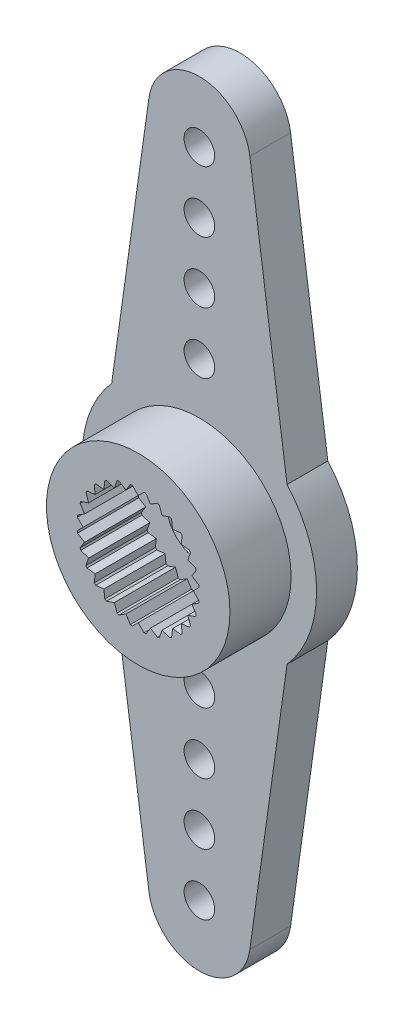
from build123d import *

# Parameters (mm, degrees)
ESQUISSE1_R                  = 5.75
ESQUISSE1_R_2                = 1.6
BOSS_EXTRU_1_DEPTH           = 5
ESQUISSE2_R                  = 3
ENL_V_MAT_EXTRU_1_DEPTH      = 3
ENL_V_START                  = -3
ESQUISSE3_R                  = 5.75
ESQUISSE3_R_2                = 4.5
ENL_V_MAT_EXTRU_2_DEPTH      = 3
BOSS_EXTRU_2_DEPTH           = 2
R_P_TITION_CIRCULAIRE1_COUNT = 2
ESQUISSE5_R                  = 0.75
ENL_V_MAT_EXTRU_3_DEPTH      = 3
R_P_TITION_CIRCULAIRE2_COUNT = 2
BOSS_EXTRU_3_DEPTH           = 3
R_P_TITION_CIRCULAIRE3_COUNT = 28
ENL_V_START_2                = -1
ESQUISSE7_R                  = 3
ESQUISSE7_R_2                = 1.6
ENL_V_MAT_EXTRU_4_DEPTH      = 1
ESQUISSE8_R                  = 4.7
ESQUISSE8_R_2                = 3.4
ENL_V_MAT_EXTRU_5_DEPTH      = 1


with BuildPart() as part:
    # Esquisse1 → Boss.-Extru.1 (new body)
    with BuildSketch(Plane.XY):
        Circle(ESQUISSE1_R)
        Circle(ESQUISSE1_R_2, mode=Mode.SUBTRACT)
    extrude(amount=BOSS_EXTRU_1_DEPTH)

    # Esquisse2 → Enlèv. mat.-Extru.1 (cut)
    with BuildSketch(Plane.XY.offset(5)):
        Circle(ESQUISSE2_R)
    extrude(amount=-ENL_V_MAT_EXTRU_1_DEPTH, mode=Mode.SUBTRACT)

    # Esquisse3 → Enlèv. mat.-Extru.2 (cut)
    with BuildSketch(Plane.XY.offset(5).offset(ENL_V_START)):
        Circle(ESQUISSE3_R)
        Circle(ESQUISSE3_R_2, mode=Mode.SUBTRACT)
    extrude(amount=ENL_V_MAT_EXTRU_2_DEPTH, mode=Mode.SUBTRACT)

    # Esquisse4 → Boss.-Extru.2 (add)
    with BuildSketch(Plane(origin=(0, 0, 0), x_dir=(-1, 0, 0), z_dir=(0, 0, -1))):
        with BuildLine():
            Line((-4.3, 3.817394399), (-2.475852955, 16.846629695))
            ThreePointArc((-2.475852955, 16.846629695), (0, 19), (2.475852955, 16.846629695))
            Line((2.475852955, 16.846629695), (4.3, 3.817394399))
            ThreePointArc((4.3, 3.817394399), (0, 5.75), (-4.3, 3.817394399))
        make_face()
    boss_extru_2 = extrude(amount=-BOSS_EXTRU_2_DEPTH)

    # Répétition circulaire1: Boss.-Extru.2 ×2 about axis
    r_p_tition_circulaire1_axis = Axis((0, 0, 0), (0, 0, 1))
    for i in range(1, R_P_TITION_CIRCULAIRE1_COUNT):
        add(boss_extru_2.rotate(r_p_tition_circulaire1_axis, i * 360 / R_P_TITION_CIRCULAIRE1_COUNT))

    # Esquisse5 → Enlèv. mat.-Extru.3 (cut)
    with BuildSketch(Plane(origin=(0, 0, 0), x_dir=(-1, 0, 0), z_dir=(0, 0, -1))):
        with Locations((0, 7)):
            Circle(ESQUISSE5_R)
        with Locations((0, 10)):
            Circle(ESQUISSE5_R)
        with Locations((0, 13)):
            Circle(ESQUISSE5_R)
        with Locations((0, 16)):
            Circle(ESQUISSE5_R)
    enl_v_mat_extru_3 = extrude(amount=-ENL_V_MAT_EXTRU_3_DEPTH, mode=Mode.SUBTRACT)

    # Répétition circulaire2: Enlèv. mat.-Extru.3 ×2 about axis
    r_p_tition_circulaire2_axis = Axis((0, 0, 0), (0, 0, 1))
    for i in range(1, R_P_TITION_CIRCULAIRE2_COUNT):
        add(enl_v_mat_extru_3.rotate(r_p_tition_circulaire2_axis, i * 360 / R_P_TITION_CIRCULAIRE2_COUNT), mode=Mode.SUBTRACT)

    # Esquisse6 → Boss.-Extru.3 (add)
    with BuildSketch(Plane.XY.offset(5)):
        Polygon((-0.3, 3), (0, 2.7), (0.3, 3), align=None)
    boss_extru_3 = extrude(amount=-BOSS_EXTRU_3_DEPTH)

    # Répétition circulaire3: Boss.-Extru.3 ×28 about axis
    r_p_tition_circulaire3_axis = Axis((0, 0, 0), (0, 0, 1))
    for i in range(1, R_P_TITION_CIRCULAIRE3_COUNT):
        add(boss_extru_3.rotate(r_p_tition_circulaire3_axis, i * 360 / R_P_TITION_CIRCULAIRE3_COUNT))

    # Esquisse7 → Enlèv. mat.-Extru.4 (cut)
    with BuildSketch(Plane(origin=(0, 0, 0), x_dir=(-1, 0, 0), z_dir=(0, 0, -1)).offset(ENL_V_START_2)):
        Circle(ESQUISSE7_R)
        Circle(ESQUISSE7_R_2, mode=Mode.SUBTRACT)
    extrude(amount=ENL_V_MAT_EXTRU_4_DEPTH, mode=Mode.SUBTRACT)

    # Esquisse8 → Enlèv. mat.-Extru.5 (cut)
    with BuildSketch(Plane(origin=(0, 0, 0), x_dir=(-1, 0, 0), z_dir=(0, 0, -1))):
        Circle(ESQUISSE8_R)
        Circle(ESQUISSE8_R_2, mode=Mode.SUBTRACT)
    extrude(amount=-ENL_V_MAT_EXTRU_5_DEPTH, mode=Mode.SUBTRACT)


solid = part.part
